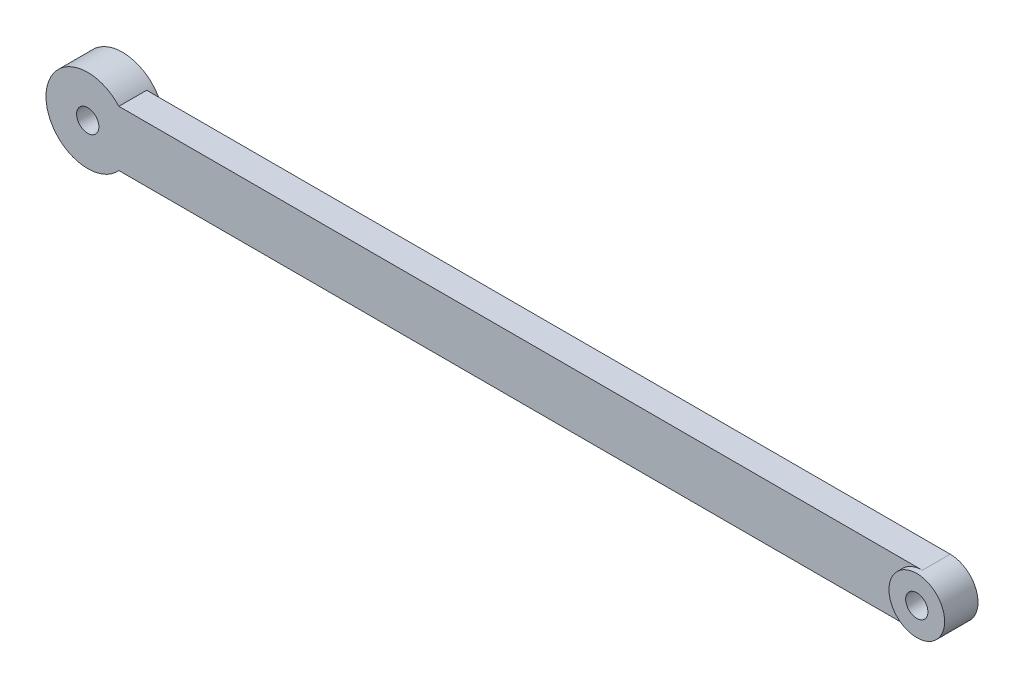
from build123d import *

# Parameters (mm, degrees)
SKETCH1_R             = 15
BOSS_EXTRUDE1_DEPTH   = 10
SKETCH1_R_2           = 10
BOSS_EXTRUDE1_2_DEPTH = 10
BOSS_EXTRUDE3_DEPTH   = 10
SKETCH13_R            = 4
CUT_EXTRUDE1_DEPTH    = 20
BOSS_EXTRUDE7_START   = 2.5
SKETCH14_R            = 15
SKETCH14_R_2          = 4
BOSS_EXTRUDE7_DEPTH   = 2.5
SKETCH15_R            = 4
BOSS_EXTRUDE8_DEPTH   = 2
ECHELLE1_SCALE        = 0.6


with BuildPart() as part:
    # Sketch1 → Boss-Extrude1 (new body)
    with BuildSketch(Plane.XY):
        Circle(SKETCH1_R)
    extrude(amount=BOSS_EXTRUDE1_DEPTH)



with BuildPart() as body_2:
    # Sketch1 → Boss-Extrude1 2 (new body)
    with BuildSketch(Plane.XY):
        with Locations((300, 0)):
            Circle(SKETCH1_R_2)
    extrude(amount=BOSS_EXTRUDE1_2_DEPTH)


with BuildPart() as part_1:
    add(part.part)

    add(body_2.part)  # Boss-Extrude3 merges body 2
    # Sketch5 → Boss-Extrude3 (add)
    with BuildSketch(Plane.XY):
        with BuildLine():
            Line((300, 10), (11.180339887, 10))
            ThreePointArc((11.180339887, 10), (14.012585384, 5.352331347), (15, 0))
            ThreePointArc((15, 0), (14.012585384, -5.352331347), (11.180339887, -10))
            Line((11.180339887, -10), (300, -10))
            ThreePointArc((300, -10), (290, 0), (300, 10))
        make_face()
    extrude(amount=BOSS_EXTRUDE3_DEPTH)

    # Sketch13 → Cut-Extrude1 (cut)
    with BuildSketch(Plane(origin=(0, 0, 0), x_dir=(-1, 0, 0), z_dir=(0, 0, -1))):
        with Locations((-300, 0)):
            Circle(SKETCH13_R)
        Circle(SKETCH13_R)
    extrude(amount=-CUT_EXTRUDE1_DEPTH, mode=Mode.SUBTRACT)

    # Sketch14 → Boss-Extrude7 (add)
    with BuildSketch(Plane(origin=(0, 0, 0), x_dir=(-1, 0, 0), z_dir=(0, 0, -1)).offset(BOSS_EXTRUDE7_START)):
        Circle(SKETCH14_R)
        Circle(SKETCH14_R_2, mode=Mode.SUBTRACT)
    extrude(amount=-BOSS_EXTRUDE7_DEPTH)

    # Sketch15 → Boss-Extrude8 (add)
    with BuildSketch(Plane.XY.offset(10)):
        with BuildLine():
            ThreePointArc((300, 10), (290, 0), (300, -10))
            ThreePointArc((300, -10), (307.071067812, -7.071067812), (310, 0))
            ThreePointArc((310, 0), (307.071067812, 7.071067812), (300, 10))
        make_face()
        with Locations(Location((300, 0, 0), (0, 0, 180))):
            Circle(SKETCH15_R, mode=Mode.SUBTRACT)
    extrude(amount=BOSS_EXTRUDE8_DEPTH)


with BuildPart() as part_2:
    # Echelle1: scaled about (141.196241325, 0, 4.894209778)
    add(part_1.part.scale(ECHELLE1_SCALE).moved(Location((56.47849653, 0, 1.957683911))))


solid = part_2.part
